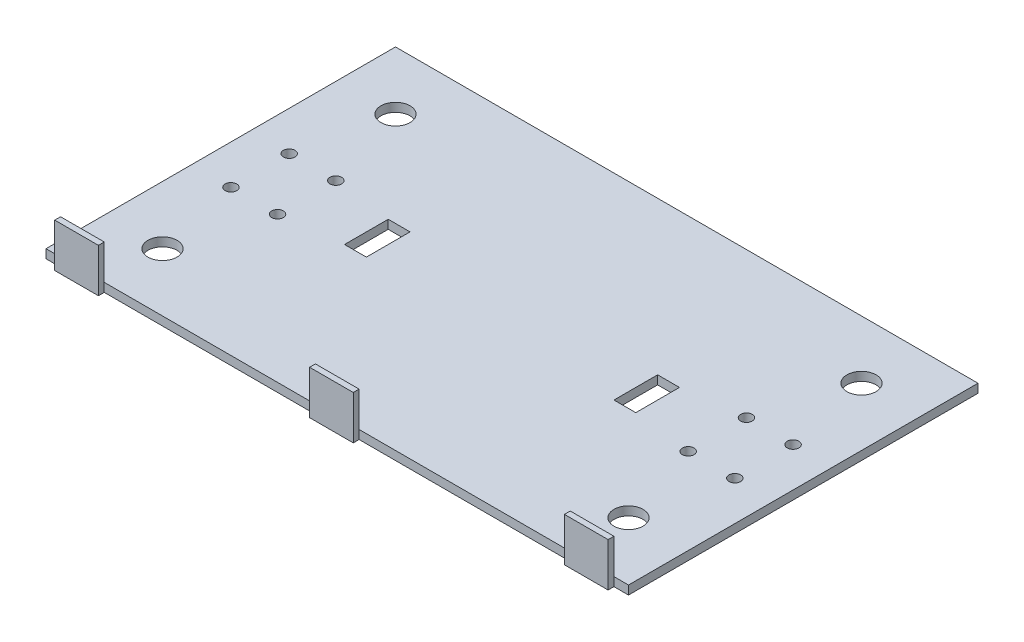
from build123d import *

# Parameters (mm, degrees)
SKETCH1_W           = 200
SKETCH1_H           = 120
BOSS_EXTRUDE3_DEPTH = 1
SKETCH3_W           = 200
SKETCH3_H           = 120
SKETCH3_R           = 5
BOSS_EXTRUDE4_DEPTH = 2
SKETCH10_W          = 15
SKETCH10_H          = 15
BOSS_EXTRUDE6_DEPTH = 2
SKETCH12_R          = 2
SKETCH12_W          = 7.5
SKETCH12_H          = 15
CUT_EXTRUDE1_DEPTH  = 119.612815496
CUT_EXTRUDE2_START  = -10
SKETCH8_R           = 5
CUT_EXTRUDE2_DEPTH  = 10


with BuildPart() as part:
    # Sketch1 → Boss-Extrude3 (new body)
    with BuildSketch(Plane(origin=(0, 0, 0), x_dir=(1, 0, 0), z_dir=(0, 1, 0))):
        Rectangle(SKETCH1_W, SKETCH1_H)
    extrude(amount=BOSS_EXTRUDE3_DEPTH)

    # Sketch3 → Boss-Extrude4 (add)
    # profile 1 of 4: a face of its own
    with BuildSketch(Plane(origin=(0, 1, 0), x_dir=(1, 0, 0), z_dir=(0, 1, 0))):
        Rectangle(SKETCH3_W, SKETCH3_H)
        with Locations(Location((-80, -40, 0), (0, 0, 270))):
            Circle(SKETCH3_R, mode=Mode.SUBTRACT)
        with Locations(Location((80, -40, 0), (0, 0, 270))):
            Circle(SKETCH3_R, mode=Mode.SUBTRACT)
        with Locations(Location((-80, 40, 0), (0, 0, 270))):
            Circle(SKETCH3_R, mode=Mode.SUBTRACT)
        with Locations(Location((80, 40, 0), (0, 0, 270))):
            Circle(SKETCH3_R, mode=Mode.SUBTRACT)
    # profile 2 of 4: a face of its own
    with BuildSketch(Plane(origin=(0, 1, 0), x_dir=(1, 0, 0), z_dir=(0, 1, 0))):
        Rectangle(SKETCH3_W, SKETCH3_H)
        with Locations(Location((-80, -40, 0), (0, 0, 270))):
            Circle(SKETCH3_R, mode=Mode.SUBTRACT)
        with Locations(Location((80, -40, 0), (0, 0, 270))):
            Circle(SKETCH3_R, mode=Mode.SUBTRACT)
        with Locations(Location((-80, 40, 0), (0, 0, 270))):
            Circle(SKETCH3_R, mode=Mode.SUBTRACT)
        with Locations(Location((80, 40, 0), (0, 0, 270))):
            Circle(SKETCH3_R, mode=Mode.SUBTRACT)
    # profile 3 of 4: a face of its own
    with BuildSketch(Plane(origin=(0, 1, 0), x_dir=(1, 0, 0), z_dir=(0, 1, 0))):
        Rectangle(SKETCH3_W, SKETCH3_H)
        with Locations(Location((-80, -40, 0), (0, 0, 270))):
            Circle(SKETCH3_R, mode=Mode.SUBTRACT)
        with Locations(Location((80, -40, 0), (0, 0, 270))):
            Circle(SKETCH3_R, mode=Mode.SUBTRACT)
        with Locations(Location((-80, 40, 0), (0, 0, 270))):
            Circle(SKETCH3_R, mode=Mode.SUBTRACT)
        with Locations(Location((80, 40, 0), (0, 0, 270))):
            Circle(SKETCH3_R, mode=Mode.SUBTRACT)
    # profile 4 of 4: a face of its own
    with BuildSketch(Plane(origin=(0, 1, 0), x_dir=(1, 0, 0), z_dir=(0, 1, 0))):
        Rectangle(SKETCH3_W, SKETCH3_H)
        with Locations(Location((-80, -40, 0), (0, 0, 270))):
            Circle(SKETCH3_R, mode=Mode.SUBTRACT)
        with Locations(Location((80, -40, 0), (0, 0, 270))):
            Circle(SKETCH3_R, mode=Mode.SUBTRACT)
        with Locations(Location((-80, 40, 0), (0, 0, 270))):
            Circle(SKETCH3_R, mode=Mode.SUBTRACT)
        with Locations(Location((80, 40, 0), (0, 0, 270))):
            Circle(SKETCH3_R, mode=Mode.SUBTRACT)
    extrude(amount=BOSS_EXTRUDE4_DEPTH)

    # Sketch10 → Boss-Extrude6 (add)
    with BuildSketch(Plane.XY.offset(60)):
        with Locations((-87.5, 7.5)):
            Rectangle(SKETCH10_W, SKETCH10_H)
        with Locations((87.5, 7.5)):
            Rectangle(SKETCH10_W, SKETCH10_H)
        with Locations((0, 7.5)):
            Rectangle(SKETCH10_W, SKETCH10_H)
    extrude(amount=BOSS_EXTRUDE6_DEPTH)

    # Sketch12 → Cut-Extrude1 (cut, through all)
    with BuildSketch(Plane.XZ):
        with Locations(Location((-86.5, 10, 0), (0, 0, 270))):
            Circle(SKETCH12_R)
        with Locations(Location((-70.5, 10, 0), (0, 0, 270))):
            Circle(SKETCH12_R)
        with Locations(Location((-70.5, -10, 0), (0, 0, 90))):
            Circle(SKETCH12_R)
        with Locations(Location((-86.5, -10, 0), (0, 0, 90))):
            Circle(SKETCH12_R)
        with Locations(Location((86.5, -10, 0), (0, 0, 270))):
            Circle(SKETCH12_R)
        with Locations(Location((70.5, -10, 0), (0, 0, 270))):
            Circle(SKETCH12_R)
        with Locations(Location((70.5, 10, 0), (0, 0, 90))):
            Circle(SKETCH12_R)
        with Locations(Location((86.5, 10, 0), (0, 0, 90))):
            Circle(SKETCH12_R)
        with Locations((46.25, 0)):
            Rectangle(SKETCH12_W, SKETCH12_H)
        with Locations((-46.25, 0)):
            Rectangle(SKETCH12_W, SKETCH12_H)
    extrude(amount=-CUT_EXTRUDE1_DEPTH, mode=Mode.SUBTRACT)

    # Sketch8 → Cut-Extrude2 (cut)
    with BuildSketch(Plane(origin=(0, 3, 0), x_dir=(1, 0, 0), z_dir=(0, 1, 0)).offset(CUT_EXTRUDE2_START)):
        with Locations(Location((-80, 40, 0), (0, 0, 270))):
            Circle(SKETCH8_R)
        with Locations(Location((80, 40, 0), (0, 0, 270))):
            Circle(SKETCH8_R)
        with Locations(Location((80, -40, 0), (0, 0, 270))):
            Circle(SKETCH8_R)
        with Locations(Location((-80, -40, 0), (0, 0, 270))):
            Circle(SKETCH8_R)
    extrude(amount=CUT_EXTRUDE2_DEPTH, mode=Mode.SUBTRACT)


solid = part.part
